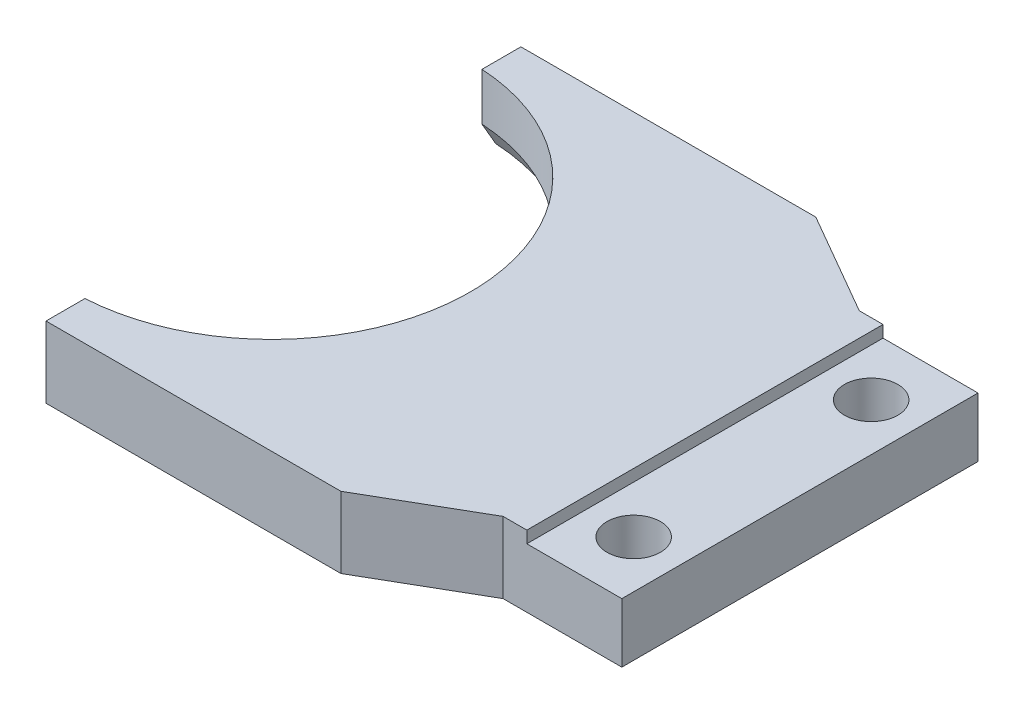
from build123d import *

# Parameters (mm, degrees)
CROQUIS1_R              = 2.25
SALIENTE_EXTRUIR2_DEPTH = 6
CROQUIS2_W              = 8
CROQUIS2_H              = 30
CORTAR_EXTRUIR1_DEPTH   = 1


with BuildPart() as part:
    # Croquis1 → Saliente-Extruir2 (new body)
    with BuildSketch(Plane(origin=(0, 0, 0), x_dir=(1, 0, 0), z_dir=(0, 1, 0))):
        with BuildLine():
            Line((1, 20), (25.839745962, 20))
            Line((25.839745962, 20), (34.5, 15))
            Line((34.5, 15), (44.5, 15))
            Line((44.5, 15), (44.5, -15))
            Line((44.5, -15), (34.5, -15))
            Line((34.5, -15), (25.839745962, -20))
            Line((25.839745962, -20), (1, -20))
            Line((1, -20), (1, -16.720122607))
            ThreePointArc((1, -16.720122607), (16.75, 0), (1, 16.720122607))
            Line((1, 16.720122607), (1, 20))
        make_face()
        with Locations(Location((40.5, 10, 0), (0, 0, 270))):
            Circle(CROQUIS1_R, mode=Mode.SUBTRACT)
        with Locations(Location((40.5, -10, 0), (0, 0, 270))):
            Circle(CROQUIS1_R, mode=Mode.SUBTRACT)
    extrude(amount=SALIENTE_EXTRUIR2_DEPTH)

    # Croquis2 → Cortar-Extruir1 (cut)
    with BuildSketch(Plane(origin=(0, 6, 0), x_dir=(1, 0, 0), z_dir=(0, 1, 0))):
        with Locations((40.5, 0)):
            Rectangle(CROQUIS2_W, CROQUIS2_H)
    extrude(amount=-CORTAR_EXTRUIR1_DEPTH, mode=Mode.SUBTRACT)

    # Croquis3 → Cortar-Revolución1 (revolve, cut)
    with BuildSketch(Plane.XY):
        Polygon((16.75, 0), (16.75, 2), (17.904700538, 0), align=None)
    revolve(axis=Axis((0, 6, 0), (0, -1, 0)), mode=Mode.SUBTRACT)


solid = part.part
